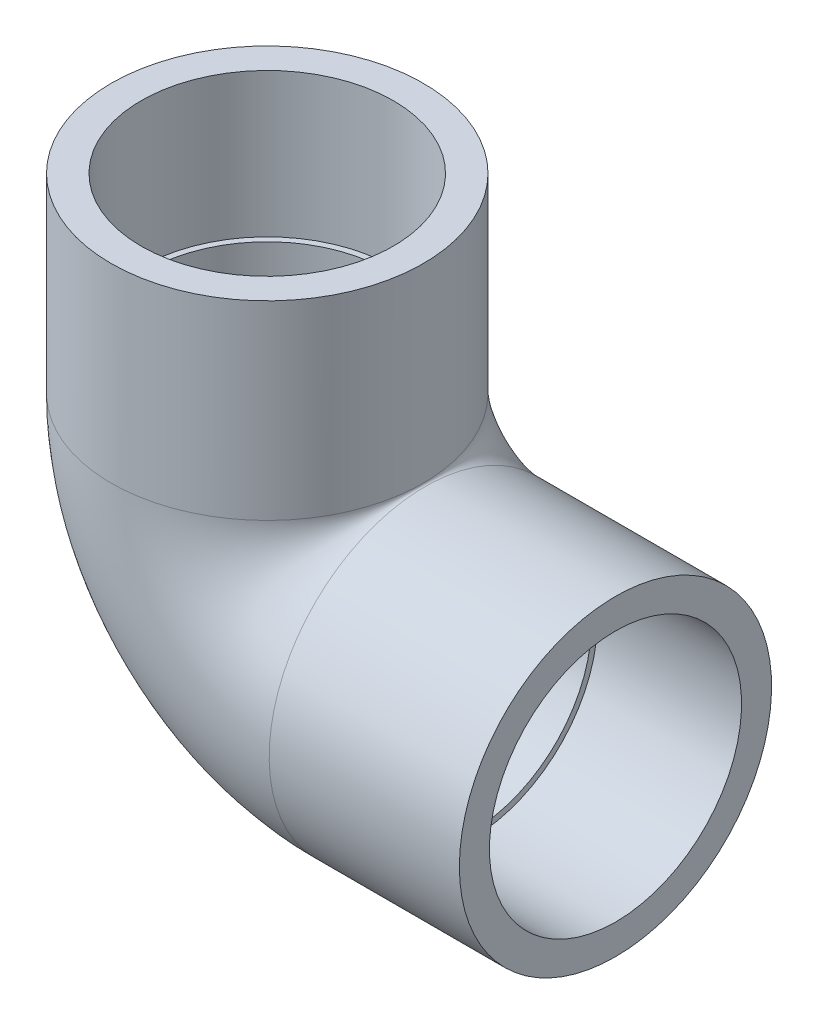
from build123d import *

# Parameters (mm, degrees)
SKETCH1_R          = 20.6375
SKETCH1_R_2        = 15.875
SKETCH3_R          = 16.66875
CUT_EXTRUDE1_DEPTH = 19.05
SKETCH5_R          = 16.66875
CUT_EXTRUDE2_DEPTH = 19.05


with BuildPart() as part:
    # Sweep3: sweep along a path in Sketch2
    with BuildLine(Plane.XY) as sweep3_path:
        Line((0, 0), (0, -25.146))
        ThreePointArc((0, -25.146), (6.118978681, -39.918521319), (20.8915, -46.0375))
        Line((20.8915, -46.0375), (46.0375, -46.0375))
    # Sketch1 → Sweep3 (sweep)
    with BuildSketch(Plane(origin=(0, 0, 0), x_dir=(1, 0, 0), z_dir=(0, 1, 0))):
        Circle(SKETCH1_R)
        Circle(SKETCH1_R_2, mode=Mode.SUBTRACT)
    sweep(path=sweep3_path.line)

    # Sketch3 → Cut-Extrude1 (cut)
    with BuildSketch(Plane(origin=(46.0375, 0, 0), x_dir=(0, 0, -1), z_dir=(1, 0, 0))):
        with Locations(Location((0, -46.0375, 0), (0, 0, 90))):
            Circle(SKETCH3_R)
    extrude(amount=-CUT_EXTRUDE1_DEPTH, mode=Mode.SUBTRACT)

    # Sketch5 → Cut-Extrude2 (cut)
    with BuildSketch(Plane(origin=(0, 0, 0), x_dir=(1, 0, 0), z_dir=(0, 1, 0))):
        with Locations(Location((0, 0, 0), (0, 0, 270))):
            Circle(SKETCH5_R)
    extrude(amount=-CUT_EXTRUDE2_DEPTH, mode=Mode.SUBTRACT)


solid = part.part
